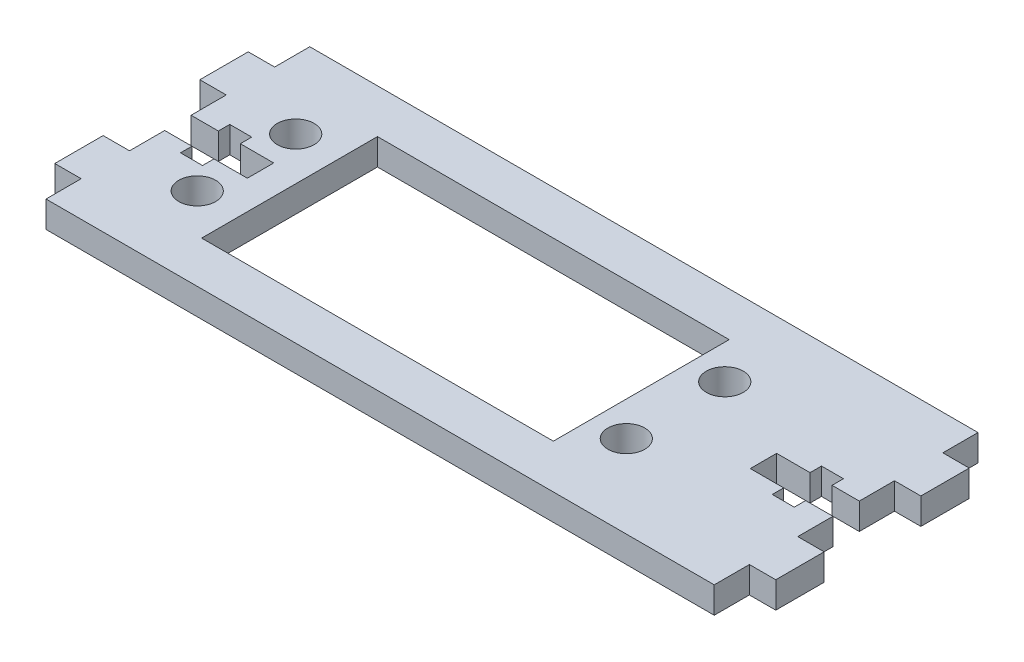
from build123d import *

# Parameters (mm, degrees)
SKETCH1_R           = 2.1
SKETCH1_W           = 40
SKETCH1_H           = 20
BOSS_EXTRUDE1_DEPTH = 3


with BuildPart() as part:
    # Sketch1 → Boss-Extrude1 (new body)
    with BuildSketch(Plane(origin=(0, 0, 0), x_dir=(1, 0, 0), z_dir=(0, 1, 0))):
        Polygon((0, 0), (-76, 0), (-76, 4), (-79, 4), (-79, 9.5), (-76, 9.5), (-76, 13.5), (-72.9, 13.5), (-72.9, 12.2), (-70.4, 12.2), (-70.4, 13.5), (-66.6, 13.5), (-66.6, 16.5), (-70.4, 16.5), (-70.4, 17.8), (-72.9, 17.8), (-72.9, 16.5), (-76, 16.5), (-76, 20.5), (-79, 20.5), (-79, 26), (-76, 26), (-76, 30), (0, 30), (0, 26), (3, 26), (3, 20.5), (0, 20.5), (0, 16.5), (-3.1, 16.5), (-3.1, 17.8), (-5.6, 17.8), (-5.6, 16.5), (-9.4, 16.5), (-9.4, 13.5), (-5.6, 13.5), (-5.6, 12.2), (-3.1, 12.2), (-3.1, 13.5), (0, 13.5), (0, 9.5), (3, 9.5), (3, 4), (0, 4), align=None)
        with Locations(Location((-19.4, 20.6, 0), (0, 0, 270))):
            Circle(SKETCH1_R, mode=Mode.SUBTRACT)
        with Locations(Location((-68.2, 20.6, 0), (0, 0, 270))):
            Circle(SKETCH1_R, mode=Mode.SUBTRACT)
        with Locations(Location((-68.2, 9.4, 0), (0, 0, 90))):
            Circle(SKETCH1_R, mode=Mode.SUBTRACT)
        with Locations(Location((-19.4, 9.4, 0), (0, 0, 90))):
            Circle(SKETCH1_R, mode=Mode.SUBTRACT)
        with Locations((-43.3, 15)):
            Rectangle(SKETCH1_W, SKETCH1_H, mode=Mode.SUBTRACT)
    extrude(amount=BOSS_EXTRUDE1_DEPTH)


solid = part.part
